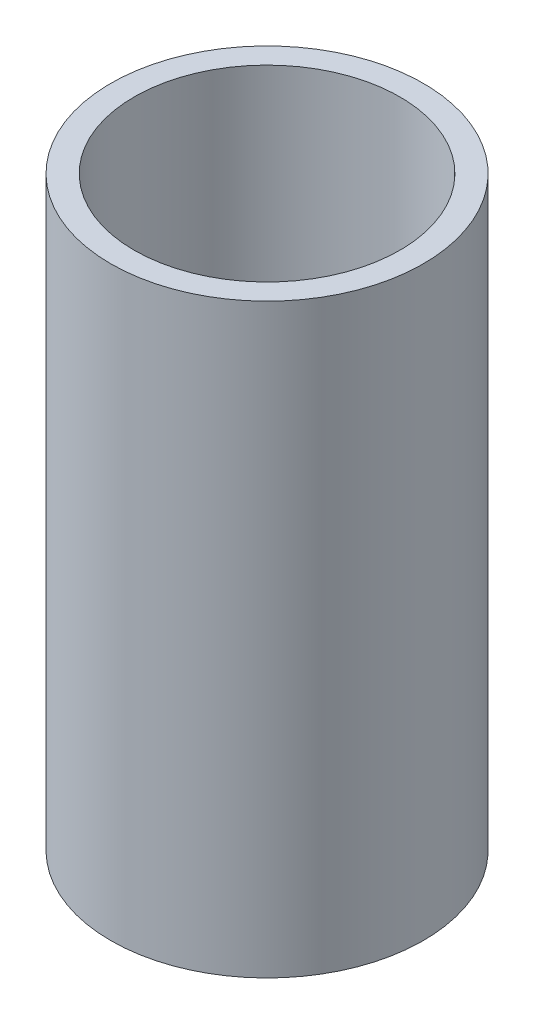
from build123d import *

# Parameters (mm, degrees)
SKETCH_1_R      = 16
SKETCH_1_R_2    = 13.6
EXTRUDE_1_DEPTH = 60


with BuildPart() as part:
    # 草图1 → 凸台-拉伸1 (new body)
    with BuildSketch(Plane(origin=(0, 0, 0), x_dir=(1, 0, 0), z_dir=(0, 1, 0))):
        with Locations(Location((0, 0, 0), (0, 0, 270))):
            Circle(SKETCH_1_R)
        with Locations(Location((0, 0, 0), (0, 0, 270))):
            Circle(SKETCH_1_R_2, mode=Mode.SUBTRACT)
    extrude(amount=EXTRUDE_1_DEPTH)


solid = part.part
